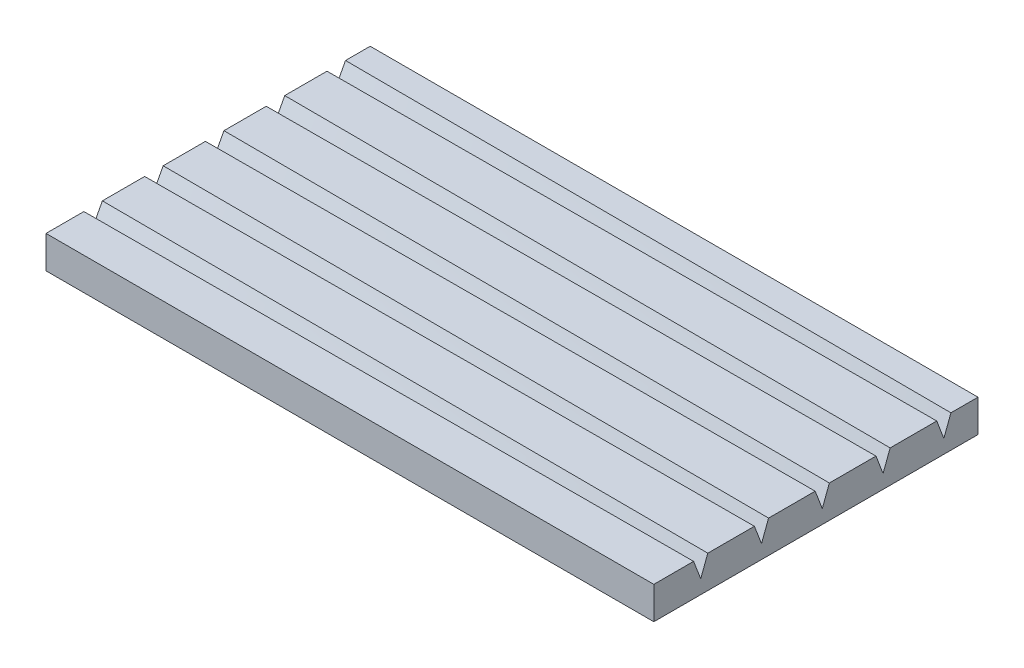
from build123d import *

# Parameters (mm, degrees)
SKETCH_1_W             = 150
SKETCH_1_H             = 80
EXTRUDE_1_DEPTH        = 8
PATTERN_LINEAR_1_COUNT = 5
PATTERN_LINEAR_1_PITCH = 15


with BuildPart() as part:
    # 草图1 → 凸台-拉伸1 (new body)
    with BuildSketch(Plane(origin=(0, 0, 0), x_dir=(1, 0, 0), z_dir=(0, 1, 0))):
        with Locations((-0.235062575, -0.022221524)):
            Rectangle(SKETCH_1_W, SKETCH_1_H)
    extrude(amount=EXTRUDE_1_DEPTH)

    # 草图7 → 切除-放样1 section 0
    with BuildSketch(Plane.ZY.offset(75.235062575)):
        with BuildLine():
            Line((-34.118346575, 8.429877802), (-29.118346575, 8.429877802))
            Line((-29.118346575, 8.429877802), (-31.471533702, 3.429877802))
            Line((-31.471533702, 3.429877802), (-34.118346575, 8.429877802))
        make_face()
    # 草图15 → 切除-放样1 section 1
    with BuildSketch(Plane.ZY.offset(-74.764937425)):
        with BuildLine():
            Line((-33.447855692, 8.401766208), (-29.647855692, 8.401766208))
            Line((-29.647855692, 8.401766208), (-31.547855692, 3.401766208))
            Line((-31.547855692, 3.401766208), (-33.447855692, 8.401766208))
        make_face()
    loft_1 = loft(mode=Mode.SUBTRACT)

    # 阵列(线性)1: 切除-放样1 ×5
    with Locations(*[(0, 0, i * PATTERN_LINEAR_1_PITCH) for i in range(1, PATTERN_LINEAR_1_COUNT)]):
        add(loft_1, mode=Mode.SUBTRACT)


solid = part.part
